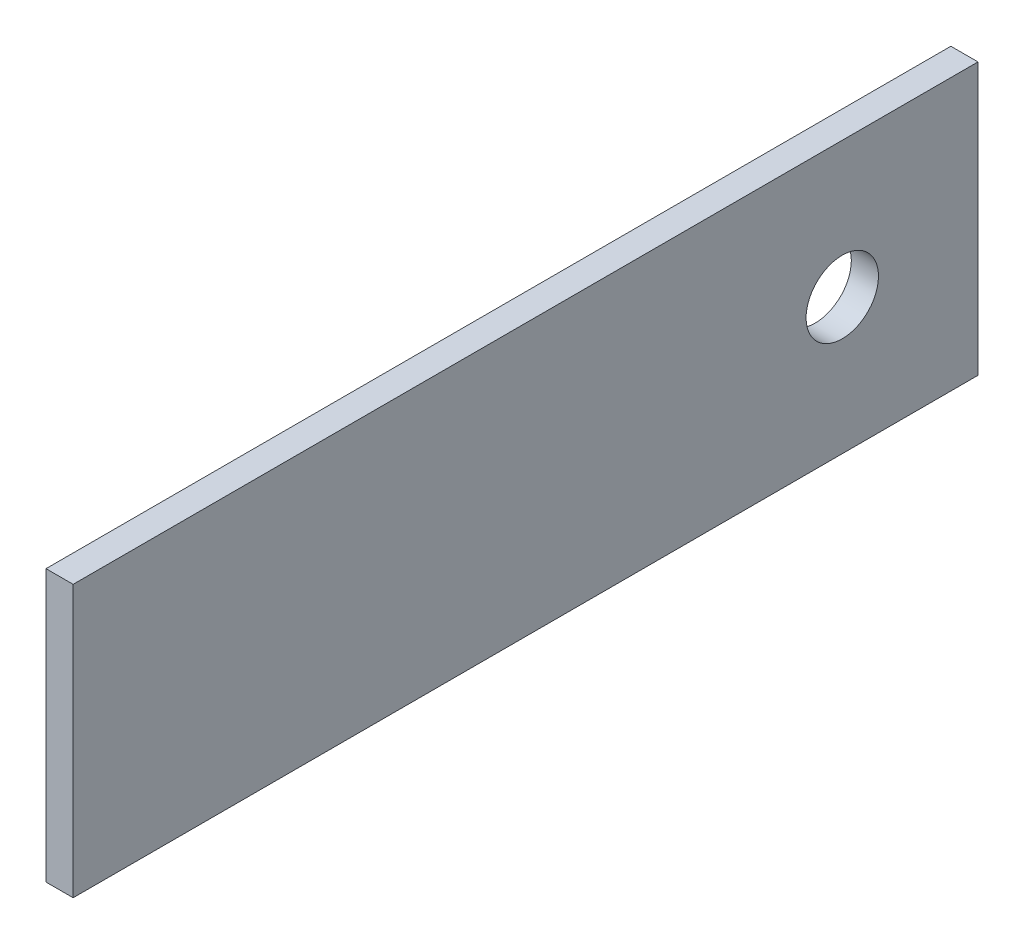
from build123d import *

# Parameters (mm, degrees)
SKETCH1_W           = 3
SKETCH1_H           = 30
BOSS_EXTRUDE1_DEPTH = 100
SKETCH3_R           = 4
CUT_EXTRUDE2_DEPTH  = 10


with BuildPart() as part:
    # Sketch1 → Boss-Extrude1 (new body)
    with BuildSketch(Plane.XY):
        with Locations((1.5, 15)):
            Rectangle(SKETCH1_W, SKETCH1_H)
    extrude(amount=BOSS_EXTRUDE1_DEPTH)

    # Sketch3 → Cut-Extrude2 (cut)
    with BuildSketch(Plane(origin=(3, 0, 0), x_dir=(0, 0, -1), z_dir=(1, 0, 0))):
        with Locations(Location((-15, 15, 0), (0, 0, 90))):
            Circle(SKETCH3_R)
    extrude(amount=-CUT_EXTRUDE2_DEPTH, mode=Mode.SUBTRACT)


solid = part.part
